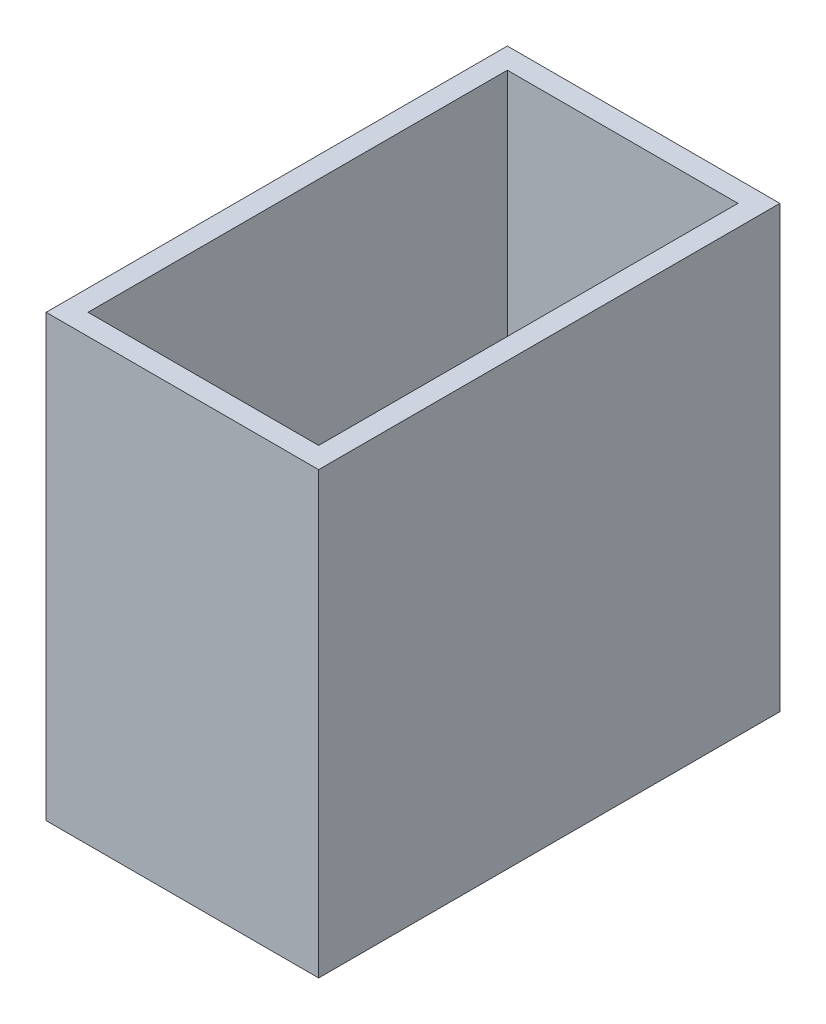
from build123d import *

# Parameters (mm, degrees)
CROQUIS1_W              = 26
CROQUIS1_H              = 44
SALIENTE_EXTRUIR1_DEPTH = 2
CROQUIS2_W              = 26
CROQUIS2_H              = 44
CROQUIS2_W_2            = 22
CROQUIS2_H_2            = 40
SALIENTE_EXTRUIR2_DEPTH = 40


with BuildPart() as part:
    # Croquis1 → Saliente-Extruir1 (new body)
    with BuildSketch(Plane(origin=(0, 0, 0), x_dir=(1, 0, 0), z_dir=(0, 1, 0))):
        Rectangle(CROQUIS1_W, CROQUIS1_H)
    extrude(amount=SALIENTE_EXTRUIR1_DEPTH)

    # Croquis2 → Saliente-Extruir2 (add)
    with BuildSketch(Plane(origin=(0, 2, 0), x_dir=(1, 0, 0), z_dir=(0, 1, 0))):
        Rectangle(CROQUIS2_W, CROQUIS2_H)
        Rectangle(CROQUIS2_W_2, CROQUIS2_H_2, mode=Mode.SUBTRACT)
    extrude(amount=SALIENTE_EXTRUIR2_DEPTH)


solid = part.part
